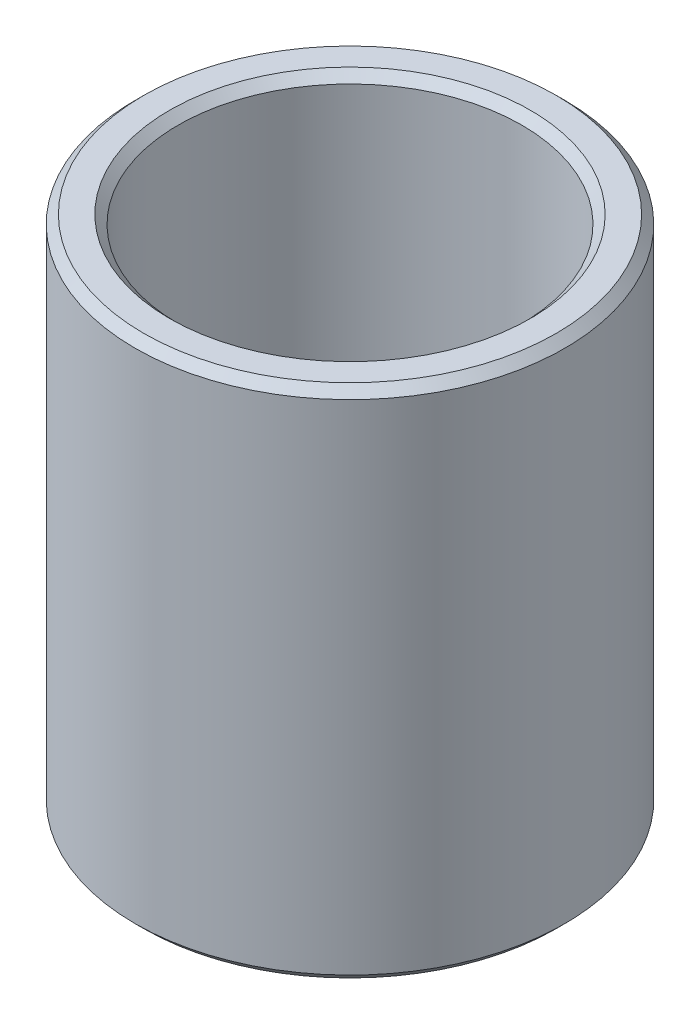
from build123d import *

# Parameters (mm, degrees)
ESQUISSE1_W     = 1
ESQUISSE1_H     = 12
CHANFREIN1_SIZE = 0.2


with BuildPart() as part:
    # Esquisse1 → Base-Révolution (revolve)
    with BuildSketch(Plane.XY, mode=Mode.PRIVATE) as base_r_volution_sk:
        with Locations((4.5, 6)):
            Rectangle(ESQUISSE1_W, ESQUISSE1_H)
    revolve(base_r_volution_sk.sketch.rotate(Axis((0, 0, 0), (0, 1, 0)), 90), axis=Axis((0, 0, 0), (0, 1, 0)))

    # Chanfrein1
    chanfrein1_edges = [part.edges().sort_by_distance(p)[0] for p in [
        (0, 12, 4),
        (0, 12, 5),
        (0, 0, 5),
        (0, 0, 4),
    ]]
    chamfer(chanfrein1_edges, length=CHANFREIN1_SIZE)


solid = part.part
